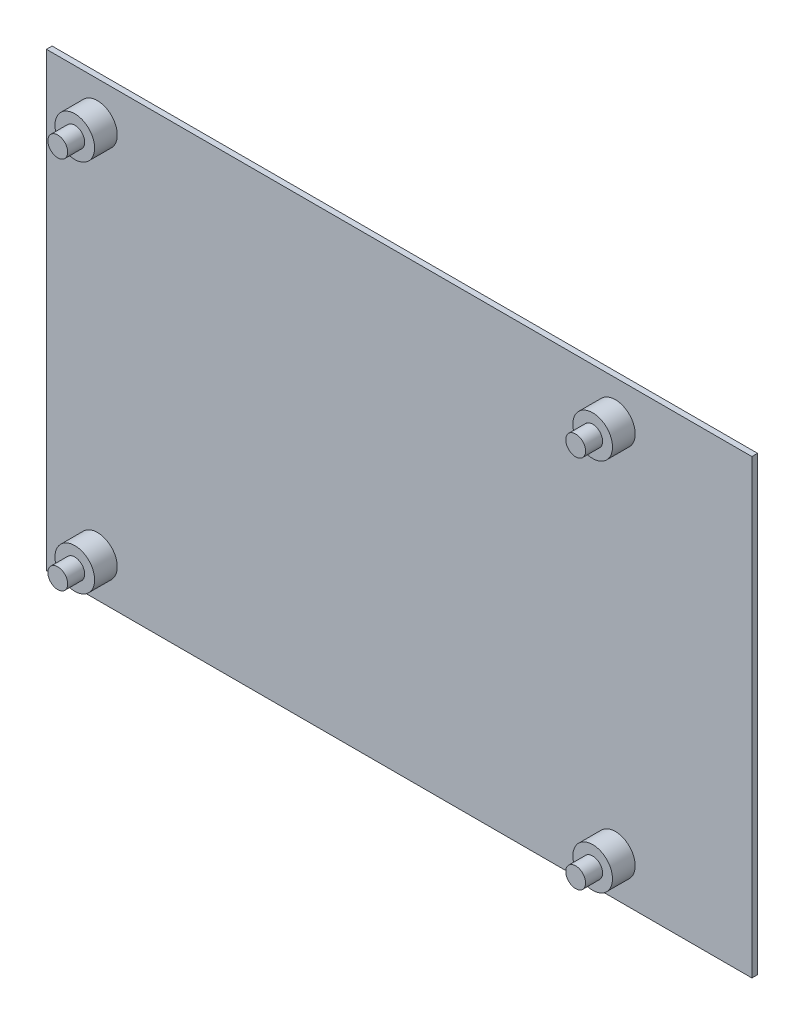
from build123d import *

# Parameters (mm, degrees)
SKETCH1_W           = 124.5
SKETCH1_H           = 79.7
BOSS_EXTRUDE1_DEPTH = 1
SKETCH2_R           = 3.5
BOSS_EXTRUDE2_DEPTH = 4
SKETCH3_R           = 1.75
BOSS_EXTRUDE3_DEPTH = 3


with BuildPart() as part:
    # Sketch1 → Boss-Extrude1 (new body)
    with BuildSketch(Plane.XY):
        with Locations((-15, -16.45)):
            Rectangle(SKETCH1_W, SKETCH1_H)
    extrude(amount=BOSS_EXTRUDE1_DEPTH)

    # Sketch2 → Boss-Extrude2 (add)
    with BuildSketch(Plane.XY.offset(1)):
        with Locations(Location((-68.25, 16.55, 0), (0, 0, 180))):
            Circle(SKETCH2_R)
        with Locations(Location((23.15, 16.55, 0), (0, 0, 180))):
            Circle(SKETCH2_R)
        with Locations(Location((23.15, -49.45, 0), (0, 0, 180))):
            Circle(SKETCH2_R)
        with Locations(Location((-68.25, -49.45, 0), (0, 0, 180))):
            Circle(SKETCH2_R)
    extrude(amount=BOSS_EXTRUDE2_DEPTH)

    # Sketch3 → Boss-Extrude3 (add)
    with BuildSketch(Plane.XY.offset(5)):
        with Locations((-68.25, 16.55)):
            Circle(SKETCH3_R)
        with Locations((23.15, 16.55)):
            Circle(SKETCH3_R)
        with Locations((23.15, -49.45)):
            Circle(SKETCH3_R)
        with Locations((-68.25, -49.45)):
            Circle(SKETCH3_R)
    extrude(amount=BOSS_EXTRUDE3_DEPTH)


solid = part.part
